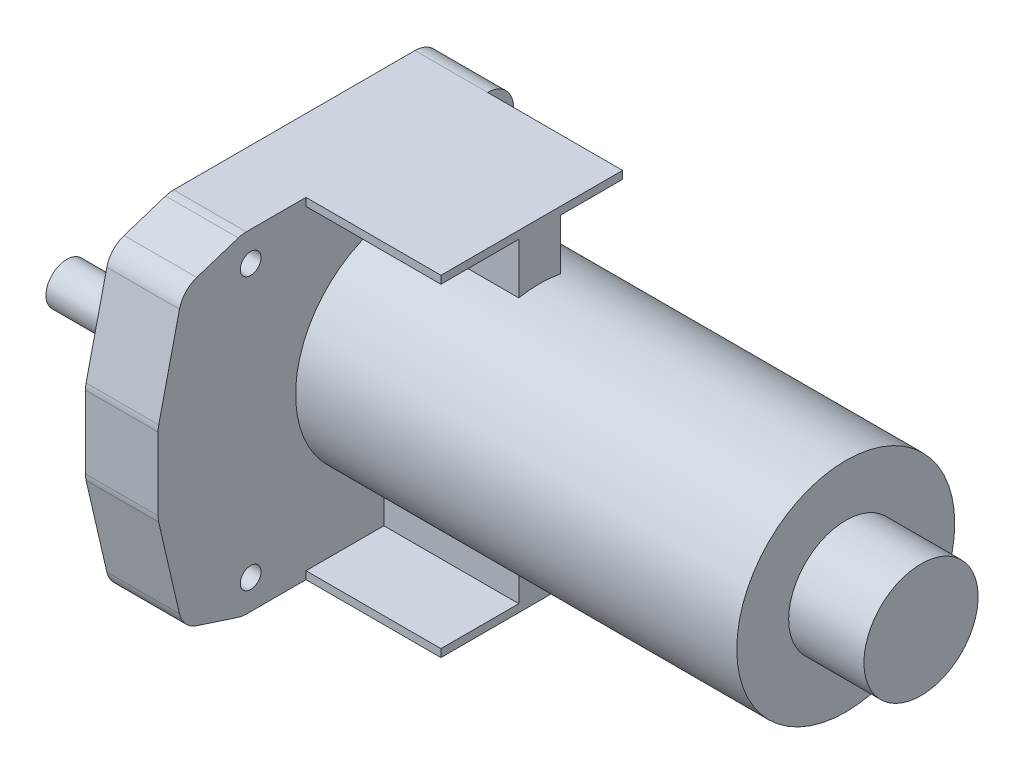
from build123d import *

# Parameters (mm, degrees)
ESQUISSE1_R       = 2
EXTRUSION3_DEPTH  = 14
ESQUISSE3_R       = 21
EXTRUSION4_DEPTH  = 85
ESQUISSE4_R       = 4
EXTRUSION5_DEPTH  = 26.6
ESQUISSE5_R       = 7.25
EXTRUSION6_DEPTH  = 5
EXTRUSION9_DEPTH  = 26
ESQUISSE9_R       = 11
EXTRUSION10_DEPTH = 14.5


with BuildPart() as part:
    # Esquisse1 → Extrusion3 (new body)
    with BuildSketch(Plane(origin=(0, 0, 0), x_dir=(0, 0, -1), z_dir=(1, 0, 0))):
        with BuildLine():
            Line((-6, 31.9), (40.5, 31.9))
            ThreePointArc((40.5, 31.9), (44.035533906, 30.435533906), (45.5, 26.9))
            Line((45.5, 26.9), (45.5, -26.9))
            ThreePointArc((45.5, -26.9), (44.035533906, -30.435533906), (40.5, -31.9))
            Line((40.5, -31.9), (-6, -31.9))
            ThreePointArc((-6, -31.9), (-6.782039696, -31.838462708), (-7.54482955, -31.655365566))
            Line((-7.54482955, -31.655365566), (-15.54482955, -29.056483056))
            ThreePointArc((-15.54482955, -29.056483056), (-17.685916108, -27.679581999), (-18.871597264, -25.426968324))
            Line((-18.871597264, -25.426968324), (-22.871597264, -8.118823709))
            ThreePointArc((-22.871597264, -8.118823709), (-22.967795604, -7.559547531), (-23, -6.992972875))
            Line((-23, -6.992972875), (-23, 6.992972875))
            ThreePointArc((-23, 6.992972875), (-22.967795604, 7.559547531), (-22.871597264, 8.118823709))
            Line((-22.871597264, 8.118823709), (-18.871597264, 25.426968324))
            ThreePointArc((-18.871597264, 25.426968324), (-17.685916108, 27.679581999), (-15.54482955, 29.056483056))
            Line((-15.54482955, 29.056483056), (-7.54482955, 31.655365566))
            ThreePointArc((-7.54482955, 31.655365566), (-6.782039696, 31.838462708), (-6, 31.9))
        make_face()
        with Locations((38.44, -26.2)):
            Circle(ESQUISSE1_R, mode=Mode.SUBTRACT)
        with Locations((-5.16, -26.2)):
            Circle(ESQUISSE1_R, mode=Mode.SUBTRACT)
        with Locations(Location((-5.16, 26.2, 0), (0, 0, 180))):
            Circle(ESQUISSE1_R, mode=Mode.SUBTRACT)
        with Locations(Location((38.44, 26.2, 0), (0, 0, 180))):
            Circle(ESQUISSE1_R, mode=Mode.SUBTRACT)
    extrude(amount=EXTRUSION3_DEPTH)

    # Esquisse3 → Extrusion4 (add)
    with BuildSketch(Plane(origin=(14, 0, 0), x_dir=(0, 0, -1), z_dir=(1, 0, 0))):
        with Locations((24.5, 0)):
            Circle(ESQUISSE3_R)
    extrude(amount=EXTRUSION4_DEPTH)

    # Esquisse4 → Extrusion5 (add)
    with BuildSketch(Plane(origin=(0, 0, 0), x_dir=(0, 0, -1), z_dir=(1, 0, 0))):
        Circle(ESQUISSE4_R)
    extrude(amount=-EXTRUSION5_DEPTH)

    # Esquisse5 → Extrusion6 (add)
    with BuildSketch(Plane(origin=(0, 0, 0), x_dir=(0, 0, -1), z_dir=(1, 0, 0))):
        Circle(ESQUISSE5_R)
    extrude(amount=-EXTRUSION6_DEPTH)

    # Esquisse8 → Extrusion9 (add)
    with BuildSketch(Plane(origin=(14, 0, 0), x_dir=(0, 0, -1), z_dir=(1, 0, 0))):
        Polygon((40.5, 31.9), (5.5, 31.9), (5.5, 30.4), (20.5, 30.4), (20.5, 13.147221685), (28.5, 13.147221685), (28.5, 30.4), (40.5, 30.4), align=None)
        Polygon((40.5, -30.4), (40.5, -31.9), (5.5, -31.9), (5.5, -30.4), (20.5, -30.4), (20.5, -13.147221685), (28.5, -13.147221685), (28.5, -30.4), align=None)
    extrude(amount=EXTRUSION9_DEPTH)

    # Esquisse9 → Extrusion10 (add)
    with BuildSketch(Plane(origin=(99, 0, 0), x_dir=(0, 0, -1), z_dir=(1, 0, 0))):
        with Locations(Location((24.5, 0, 0), (0, 0, 180))):
            Circle(ESQUISSE9_R)
    extrude(amount=EXTRUSION10_DEPTH)


solid = part.part
